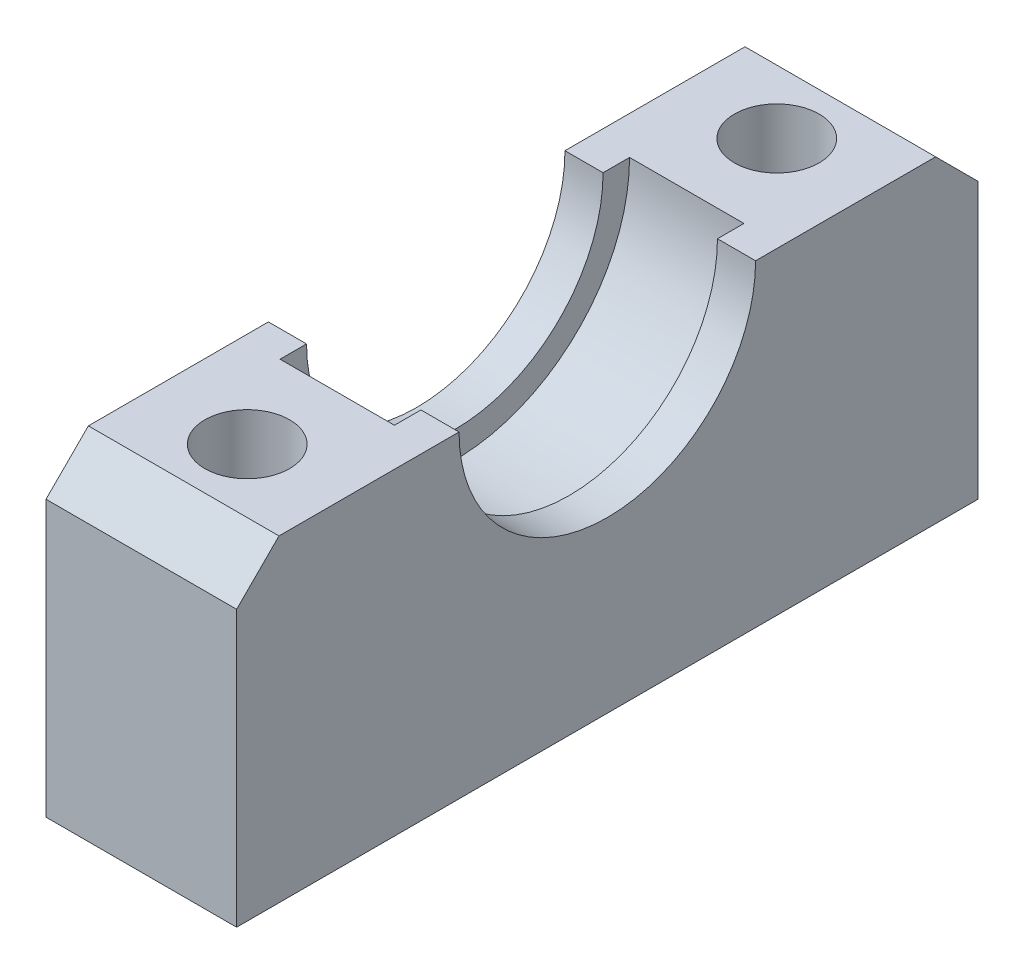
from build123d import *

# Parameters (mm, degrees)
BOSS_EXTRUDE1_DEPTH      = 4.5
BOSS_EXTRUDE1_DEPTH_BACK = 4.5
CUT_EXTRUDE1_DEPTH       = 2.7
CUT_EXTRUDE1_DEPTH_BACK  = 2.7
SKETCH2_R                = 8.25
SKETCH3_R                = 2
CUT_EXTRUDE3_DEPTH       = 24.484037132
CHAMFER1_SIZE            = 2


with BuildPart() as part:
    # Sketch1 → Boss-Extrude1 (new, two sides: drawn at the far end of the back side and taken through both)
    with BuildSketch(Plane(origin=(0, 0, 0), x_dir=(0, 0, -1), z_dir=(1, 0, 0)).offset(-BOSS_EXTRUDE1_DEPTH_BACK)):
        with BuildLine():
            Line((7, 7.5), (17.5, 7.5))
            Line((17.5, 7.5), (17.5, -7.5))
            Line((17.5, -7.5), (-17.5, -7.5))
            Line((-17.5, -7.5), (-17.5, 7.5))
            Line((-17.5, 7.5), (-7, 7.5))
            ThreePointArc((-7, 7.5), (0, 0.5), (7, 7.5))
        make_face()
    extrude(amount=BOSS_EXTRUDE1_DEPTH + BOSS_EXTRUDE1_DEPTH_BACK)

    # Sketch2 → Cut-Extrude1 (cut, two sides: drawn at the far end of the back side and taken through both)
    with BuildSketch(Plane(origin=(0, 0, 0), x_dir=(0, 0, -1), z_dir=(1, 0, 0)).offset(-CUT_EXTRUDE1_DEPTH_BACK)):
        with Locations((0, 7.5)):
            Circle(SKETCH2_R)
    extrude(amount=CUT_EXTRUDE1_DEPTH + CUT_EXTRUDE1_DEPTH_BACK, mode=Mode.SUBTRACT)

    # Sketch3 → Cut-Extrude3 (cut, through all)
    with BuildSketch(Plane(origin=(0, 7.5, 0), x_dir=(1, 0, 0), z_dir=(0, 1, 0))):
        with Locations((0, 12.5)):
            Circle(SKETCH3_R)
        with Locations((0, -12.5)):
            Circle(SKETCH3_R)
    extrude(amount=-CUT_EXTRUDE3_DEPTH, mode=Mode.SUBTRACT)

    # Chamfer1
    chamfer1_edges = [part.edges().sort_by_distance(p)[0] for p in [
        (0, 7.5, -17.5),
        (0, 7.5, 17.5),
    ]]
    chamfer(chamfer1_edges, length=CHAMFER1_SIZE)


solid = part.part
